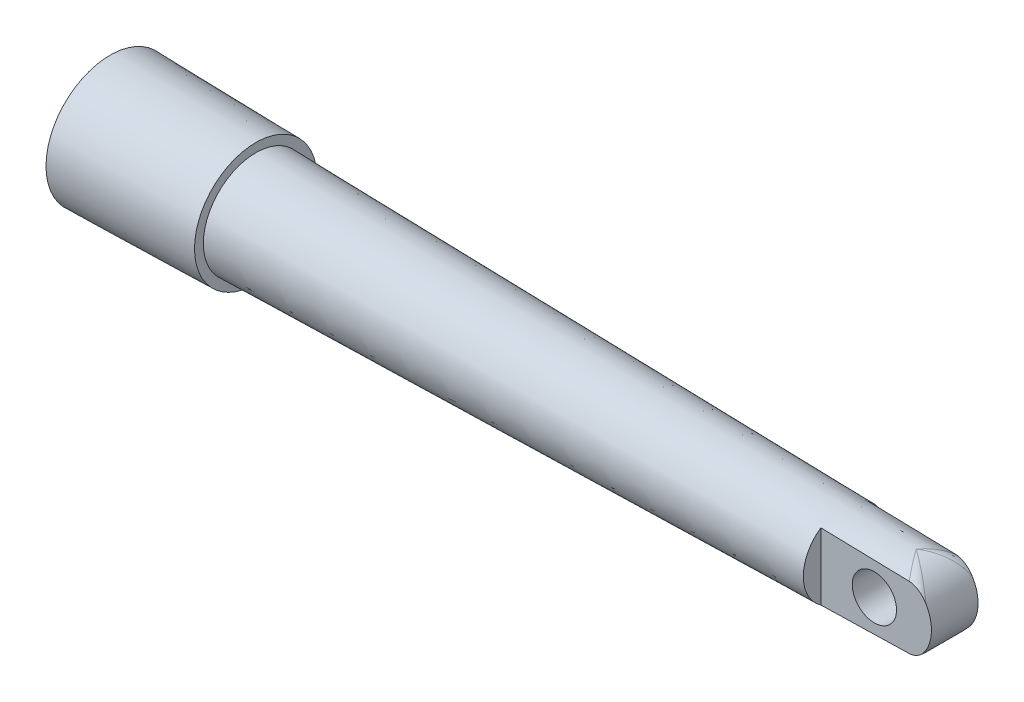
from build123d import *
from build123d.topology import SkipClean

# Parameters (mm, degrees)
BOSS_EXTRUDE1_DEPTH     = 1
CUT_EXTRUDE1_DEPTH      = 37.54772833504248
CUT_EXTRUDE1_DEPTH_BACK = 37.54772833504248
SKETCH4_R               = 0.9500000000000008
FILLET1_R               = 0.5
SKETCH5_R               = 1
CUT_EXTRUDE2_DEPTH      = 26.5


with BuildPart() as part:
    # Sketch1 → Revolve1 (revolve)
    with BuildSketch(Plane.XY, mode=Mode.PRIVATE) as revolve1_sk:
        Polygon((0, 0), (31.5, 0), (31.5, 1.7500000000000002), (6.25, 2.25), (6.25, 2.63), (-8.6e-16, 2.753762376237624), align=None)
    revolve(revolve1_sk.sketch.rotate(Axis((0, 0, 0), (1, 0, 0)), 90), axis=Axis((0, 0, 0), (1, 0, 0)))

    # Sketch2 → Boss-Extrude1 (add, symmetric)
    with BuildSketch(Plane.XY):
        with BuildLine():
            Line((31.5, 1.7500000000000002), (34.59438397289708, 1.6887250698436231))
            ThreePointArc((34.59438397289708, 1.6887250698436231), (36.250000000000384, 0), (34.59438397289708, -1.6887250698436231))
            Line((34.59438397289708, -1.6887250698436231), (31.5, -1.7500000000000002))
            Line((31.5, -1.7500000000000002), (31.5, 1.7500000000000002))
        make_face()
    extrude(amount=BOSS_EXTRUDE1_DEPTH, both=True)

    # Sketch3 → Cut-Revolve1 (revolve, cut)
    with SkipClean():  # the faces are left unmerged after this step: merging them gives an invalid solid
        with BuildSketch(Plane.XY):
            Polygon((31.5, 1.7500000000000002), (31.5, 3.02899348193033), (37.16046821617775, 3.02899348193033), (37.16046821617775, 1.6379115204717292), align=None)
        revolve(axis=Axis((31.5, 0, 0), (1, 0, 0)), mode=Mode.SUBTRACT)

    # Sketch4 → Cut-Extrude1 (cut, two sides: drawn at the far end of the back side and taken through both)
    with SkipClean():  # the faces are left unmerged after this step: merging them gives an invalid solid
        with BuildSketch(Plane.XY.offset(1).offset(-CUT_EXTRUDE1_DEPTH_BACK)):
            with Locations((33.800000000000416, 0)):
                Circle(SKETCH4_R)
        extrude(amount=CUT_EXTRUDE1_DEPTH + CUT_EXTRUDE1_DEPTH_BACK, mode=Mode.SUBTRACT)

    # Fillet1
    fillet1_edges = [part.edges().sort_by_distance(p)[0] for p in [
        (35.10948652987232, 1.5975016585971056, -0.5152035376774515),
        (35.109486521686094, -1.5975016606575614, -0.5152035294896175),
        (35.109486530948786, 1.5975016579572403, 0.5152035387541277),
        (35.10948652164611, -1.5975016610354238, 0.5152035294496282),
    ]]
    fillet(fillet1_edges, radius=FILLET1_R)

    # Sketch5 → Cut-Extrude2 (cut)
    with SkipClean():  # the faces are left unmerged after this step: merging them gives an invalid solid
        with BuildSketch(Plane.ZY):
            Circle(SKETCH5_R)
        extrude(amount=-CUT_EXTRUDE2_DEPTH, mode=Mode.SUBTRACT)


solid = part.part
